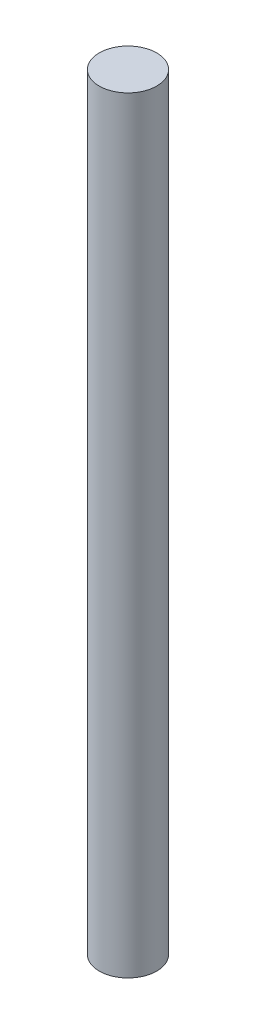
from build123d import *

# Parameters (mm, degrees)
SKETCH1_R           = 7.5
BOSS_EXTRUDE1_DEPTH = 100


with BuildPart() as part:
    # Sketch1 → Boss-Extrude1 (new, symmetric)
    with BuildSketch(Plane(origin=(0, 0, 0), x_dir=(1, 0, 0), z_dir=(0, 1, 0))):
        with Locations(Location((0, 0, 0), (0, 0, 270))):
            Circle(SKETCH1_R)
    extrude(amount=BOSS_EXTRUDE1_DEPTH, both=True)


solid = part.part
